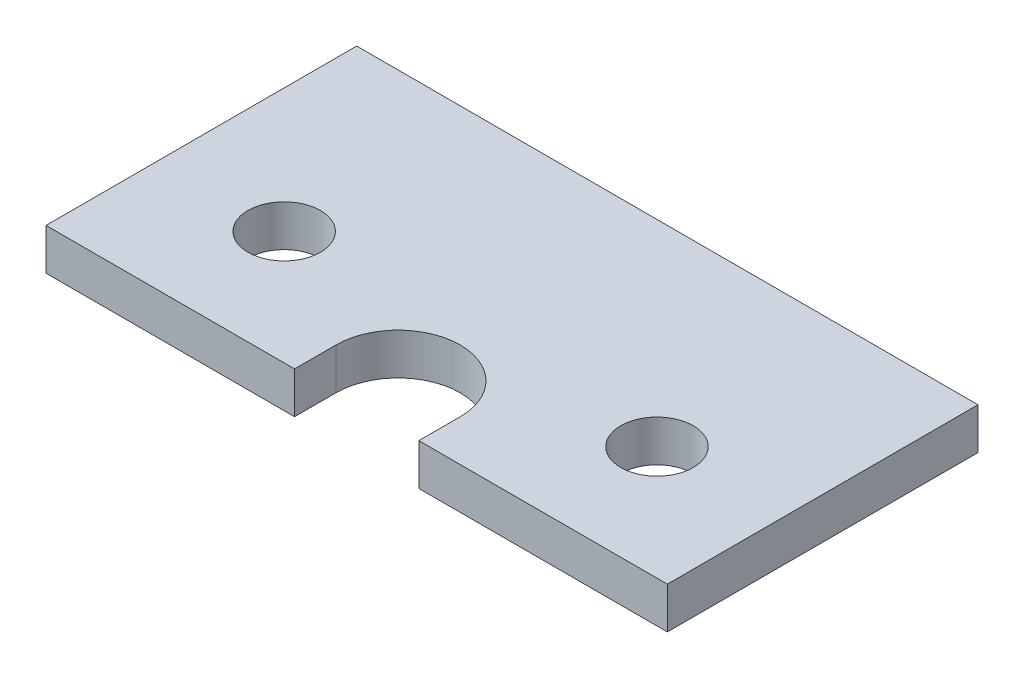
from build123d import *

# Parameters (mm, degrees)
SKETCH_1_R      = 1.75
EXTRUDE_1_DEPTH = 2


with BuildPart() as part:
    # 草圖1 → 填料-伸長1 (new body)
    with BuildSketch(Plane(origin=(0, 0, 0), x_dir=(1, 0, 0), z_dir=(0, 1, 0))):
        with BuildLine():
            Line((0, 0), (12, 0))
            Line((12, 0), (12, 2))
            ThreePointArc((12, 2), (15, 5), (18, 2))
            Line((18, 2), (18, 0))
            Line((18, 0), (30, 0))
            Line((30, 0), (30, 15))
            Line((30, 15), (0, 15))
            Line((0, 15), (0, 0))
        make_face()
        with Locations(Location((24, 5.5, 0), (0, 0, 270))):
            Circle(SKETCH_1_R, mode=Mode.SUBTRACT)
        with Locations(Location((6, 5.5, 0), (0, 0, 270))):
            Circle(SKETCH_1_R, mode=Mode.SUBTRACT)
    extrude(amount=EXTRUDE_1_DEPTH)


solid = part.part
